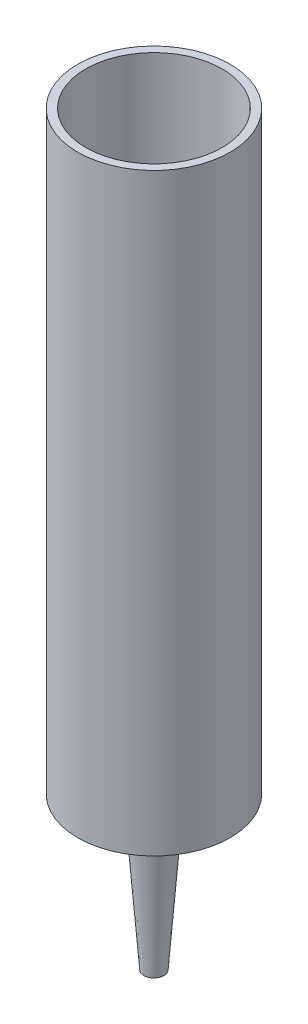
from build123d import *

# Parameters (mm, degrees)
SKETCH_1_R      = 19
SKETCH_1_R_2    = 17
EXTRUDE_1_DEPTH = 148


with BuildPart() as part:
    # 草图1 → 凸台-拉伸1 (new body)
    with BuildSketch(Plane(origin=(0, 0, 0), x_dir=(1, 0, 0), z_dir=(0, 1, 0))):
        with Locations(Location((0, 0, 0), (0, 0, 270))):
            Circle(SKETCH_1_R)
        with Locations(Location((0, 0, 0), (0, 0, 270))):
            Circle(SKETCH_1_R_2, mode=Mode.SUBTRACT)
    extrude(amount=EXTRUDE_1_DEPTH)

    # 草图6 → 旋转1 (revolve)
    with BuildSketch(Plane.XY, mode=Mode.PRIVATE) as revolve_1_sk:
        Polygon((-19, 0), (-17, 0), (-4.027808676, -4.632925473), (-1.5, -38), (-2.5, -38), (-5, -5), align=None)
    revolve(revolve_1_sk.sketch.rotate(Axis((0, 0, 0), (0, -1, 0)), 270), axis=Axis((0, 0, 0), (0, -1, 0)))


solid = part.part
